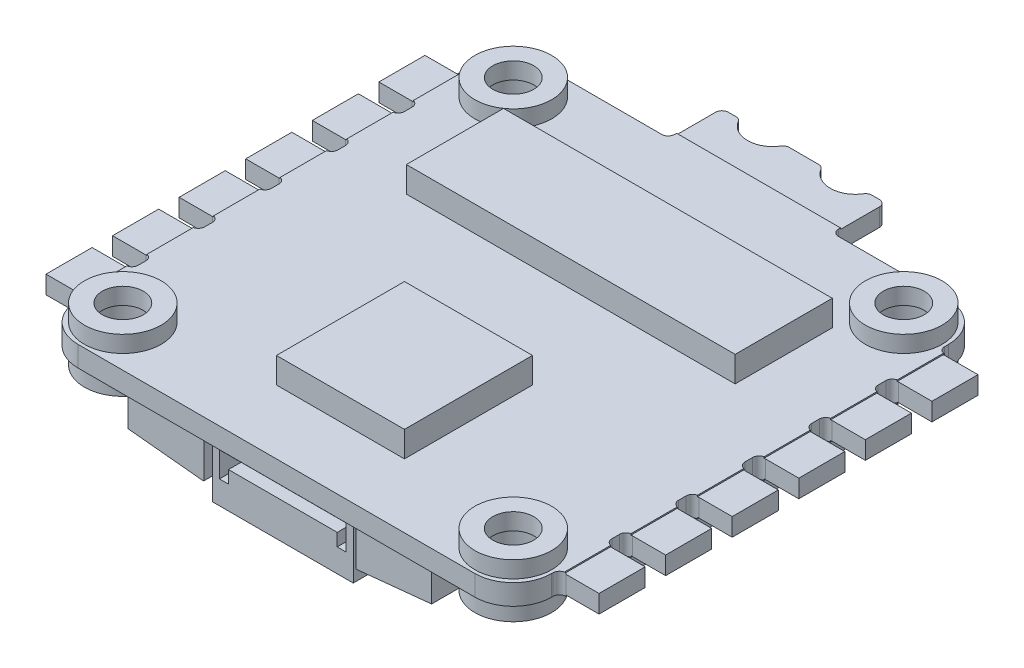
from build123d import *

# Parameters (mm, degrees)
SKETCH_1_W               = 37
SKETCH_1_H               = 37
SKETCH_1_R               = 2.25
EXTRUDE_1_DEPTH          = 1.6
FILLET_1_R               = 3
SKETCH_2_R               = 3
SKETCH_2_R_2             = 1.6
EXTRUDE_2_DEPTH          = 1.3
EXTRUDE_2_2_DEPTH        = 1.3
EXTRUDE_2_3_DEPTH        = 1.3
EXTRUDE_2_4_DEPTH        = 1.3
SKETCH_3_R               = 3
SKETCH_3_R_2             = 1.6
EXTRUDE_3_DEPTH          = 1.3
EXTRUDE_3_2_DEPTH        = 1.3
EXTRUDE_3_3_DEPTH        = 1.3
EXTRUDE_3_4_DEPTH        = 1.3
SKETCH_6_W               = 11
SKETCH_6_H               = 4.3
EXTRUDE_5_DEPTH          = 4.3
CUT_EXTRUDE_2_DEPTH      = 3.3
SKETCH_9_W               = 10
SKETCH_9_H               = 10
EXTRUDE_7_DEPTH          = 2
SKETCH_9_W_2             = 25.681025536
SKETCH_9_H_2             = 7.588093614
EXTRUDE_7_2_DEPTH        = 2
EXTRUDE_8_DEPTH          = 3
CUT_EXTRUDE_3_DEPTH      = 27.513958588
CUT_EXTRUDE_3_DEPTH_BACK = 27.513958588
SKETCH_12_W              = 3.1
SKETCH_12_H              = 3.6
EXTRUDE_9_DEPTH          = 1.6
FILLET_2_R               = 0.5
SKETCH_13_W              = 2.7
SKETCH_13_H              = 29.6
CUT_EXTRUDE_4_DEPTH      = 0.1
SKETCH_14_W              = 2.7
SKETCH_14_H              = 29.6
CUT_EXTRUDE_5_DEPTH      = 0.1
EXTRUDE_10_DEPTH         = 1.6
FILLET_3_R               = 0.5
SKETCH_16_W              = 12.8
SKETCH_16_H              = 3.89742876
CUT_EXTRUDE_6_DEPTH      = 0.1
SKETCH_17_W              = 12.8
SKETCH_17_H              = 4.147323538
CUT_EXTRUDE_7_DEPTH      = 0.1


with BuildPart() as part:
    # 草图1 → 凸台-拉伸1 (new body)
    with BuildSketch(Plane(origin=(0, 0, 0), x_dir=(1, 0, 0), z_dir=(0, 1, 0))):
        Rectangle(SKETCH_1_W, SKETCH_1_H)
        with Locations(Location((15.25, 15.25, 0), (0, 0, 270))):
            Circle(SKETCH_1_R, mode=Mode.SUBTRACT)
        with Locations(Location((15.25, -15.25, 0), (0, 0, 270))):
            Circle(SKETCH_1_R, mode=Mode.SUBTRACT)
        with Locations(Location((-15.25, -15.25, 0), (0, 0, 270))):
            Circle(SKETCH_1_R, mode=Mode.SUBTRACT)
        with Locations(Location((-15.25, 15.25, 0), (0, 0, 270))):
            Circle(SKETCH_1_R, mode=Mode.SUBTRACT)
    extrude(amount=EXTRUDE_1_DEPTH)

    # 圆角1
    fillet_1_edges = [part.edges().sort_by_distance(p)[0] for p in [
        (-18.5, 0.8, 18.5),
        (-18.5, 0.8, -18.5),
        (18.5, 0.8, -18.5),
        (18.5, 0.8, 18.5),
    ]]
    fillet(fillet_1_edges, radius=FILLET_1_R)

    # 草图12 → 凸台-拉伸9 (add)
    with BuildSketch(Plane.XZ):
        with Locations((20.05, 13.1)):
            Rectangle(SKETCH_12_W, SKETCH_12_H)
        with Locations((20.05, 7.9)):
            Rectangle(SKETCH_12_W, SKETCH_12_H)
        with Locations((20.05, 2.7)):
            Rectangle(SKETCH_12_W, SKETCH_12_H)
        with Locations((20.05, -2.5)):
            Rectangle(SKETCH_12_W, SKETCH_12_H)
        with Locations((20.05, -7.7)):
            Rectangle(SKETCH_12_W, SKETCH_12_H)
        with Locations((20.05, -12.9)):
            Rectangle(SKETCH_12_W, SKETCH_12_H)
        with Locations((-20.05, -12.9)):
            Rectangle(SKETCH_12_W, SKETCH_12_H)
        with Locations((-20.05, -7.7)):
            Rectangle(SKETCH_12_W, SKETCH_12_H)
        with Locations((-20.05, -2.5)):
            Rectangle(SKETCH_12_W, SKETCH_12_H)
        with Locations((-20.05, 2.7)):
            Rectangle(SKETCH_12_W, SKETCH_12_H)
        with Locations((-20.05, 7.9)):
            Rectangle(SKETCH_12_W, SKETCH_12_H)
        with Locations((-20.05, 13.1)):
            Rectangle(SKETCH_12_W, SKETCH_12_H)
    extrude(amount=-EXTRUDE_9_DEPTH)

    # 圆角2
    fillet_2_edges = [part.edges().sort_by_distance(p)[0] for p in [
        (18.5, 0.8, -9.5),
        (18.5, 0.8, -5.9),
        (18.5, 0.8, -14.7),
        (18.5, 0.8, -11.1),
        (-18.5, 0.8, -14.7),
        (-18.5, 0.8, -11.1),
        (-18.5, 0.8, -9.5),
        (-18.5, 0.8, -5.9),
        (-18.5, 0.8, -4.3),
        (-18.5, 0.8, -0.7),
        (-18.5, 0.8, 0.9),
        (-18.5, 0.8, 4.5),
        (-18.5, 0.8, 6.1),
        (-18.5, 0.8, 9.7),
        (-18.5, 0.8, 11.3),
        (-18.5, 0.8, 14.9),
        (18.5, 0.8, 14.9),
        (18.5, 0.8, 11.3),
        (18.5, 0.8, 6.1),
        (18.5, 0.8, 9.7),
        (18.5, 0.8, 0.9),
        (18.5, 0.8, 4.5),
        (18.5, 0.8, -4.3),
        (18.5, 0.8, -0.7),
    ]]
    fillet(fillet_2_edges, radius=FILLET_2_R)

    # 草图13 → 切除-拉伸4 (cut)
    with BuildSketch(Plane.XZ):
        with Locations((20.25, 0.1)):
            Rectangle(SKETCH_13_W, SKETCH_13_H)
        with Locations((-20.25, 0.1)):
            Rectangle(SKETCH_13_W, SKETCH_13_H)
    extrude(amount=-CUT_EXTRUDE_4_DEPTH, mode=Mode.SUBTRACT)

    # 草图14 → 切除-拉伸5 (cut)
    with BuildSketch(Plane(origin=(0, 1.6, 0), x_dir=(1, 0, 0), z_dir=(0, 1, 0))):
        with Locations((-20.25, -0.1)):
            Rectangle(SKETCH_14_W, SKETCH_14_H)
        with Locations((20.25, -0.1)):
            Rectangle(SKETCH_14_W, SKETCH_14_H)
    extrude(amount=-CUT_EXTRUDE_5_DEPTH, mode=Mode.SUBTRACT)

    # 草图15 → 凸台-拉伸10 (add)
    with BuildSketch(Plane.XZ):
        with BuildLine():
            Line((6.4, -18.5), (-6.4, -18.5))
            Line((-6.4, -18.5), (-6.4, -22.7))
            Line((-6.4, -22.7), (-5.01522308, -22.7))
            ThreePointArc((-5.01522308, -22.7), (-3.229251176, -21.535763846), (-1.443279271, -22.7))
            Line((-1.443279271, -22.7), (1.443279271, -22.7))
            ThreePointArc((1.443279271, -22.7), (3.229251176, -21.535763846), (5.01522308, -22.7))
            Line((5.01522308, -22.7), (6.4, -22.7))
            Line((6.4, -22.7), (6.4, -18.5))
        make_face()
    extrude(amount=-EXTRUDE_10_DEPTH)

    # 圆角3
    fillet_3_edges = [part.edges().sort_by_distance(p)[0] for p in [
        (-5.01522308, 0.8, -22.7),
        (-1.443279271, 0.8, -22.7),
        (1.443279271, 0.8, -22.7),
        (5.01522308, 0.8, -22.7),
        (6.4, 0.8, -22.7),
        (6.4, 0.8, -18.5),
        (-6.4, 0.8, -18.5),
        (-6.4, 0.8, -22.7),
    ]]
    fillet(fillet_3_edges, radius=FILLET_3_R)

    # 草图16 → 切除-拉伸6 (cut)
    with BuildSketch(Plane.XZ):
        with Locations((0, -21.128309583)):
            Rectangle(SKETCH_16_W, SKETCH_16_H)
    extrude(amount=-CUT_EXTRUDE_6_DEPTH, mode=Mode.SUBTRACT)

    # 草图17 → 切除-拉伸7 (cut)
    with BuildSketch(Plane(origin=(0, 1.6, 0), x_dir=(1, 0, 0), z_dir=(0, 1, 0))):
        with Locations((0, 21.232279327)):
            Rectangle(SKETCH_17_W, SKETCH_17_H)
    extrude(amount=-CUT_EXTRUDE_7_DEPTH, mode=Mode.SUBTRACT)


with BuildPart() as body_2:
    # 草图2 → 凸台-拉伸2 (new body)
    with BuildSketch(Plane.XZ):
        with Locations(Location((-15.25, 15.25, 0), (0, 0, 270))):
            Circle(SKETCH_2_R)
        with Locations(Location((-15.25, 15.25, 0), (0, 0, 270))):
            Circle(SKETCH_2_R_2, mode=Mode.SUBTRACT)
    extrude(amount=EXTRUDE_2_DEPTH)


with BuildPart() as body_3:
    # 草图2 → Extrude 2 2 (new body)
    with BuildSketch(Plane.XZ):
        with Locations(Location((15.25, 15.25, 0), (0, 0, 270))):
            Circle(SKETCH_2_R)
        with Locations(Location((15.25, 15.25, 0), (0, 0, 270))):
            Circle(SKETCH_2_R_2, mode=Mode.SUBTRACT)
    extrude(amount=EXTRUDE_2_2_DEPTH)


with BuildPart() as body_4:
    # 草图2 → Extrude 2 3 (new body)
    with BuildSketch(Plane.XZ):
        with Locations(Location((15.25, -15.25, 0), (0, 0, 270))):
            Circle(SKETCH_2_R)
        with Locations(Location((15.25, -15.25, 0), (0, 0, 270))):
            Circle(SKETCH_2_R_2, mode=Mode.SUBTRACT)
    extrude(amount=EXTRUDE_2_3_DEPTH)


with BuildPart() as body_5:
    # 草图2 → Extrude 2 4 (new body)
    with BuildSketch(Plane.XZ):
        with Locations(Location((-15.25, -15.25, 0), (0, 0, 270))):
            Circle(SKETCH_2_R)
        with Locations(Location((-15.25, -15.25, 0), (0, 0, 270))):
            Circle(SKETCH_2_R_2, mode=Mode.SUBTRACT)
    extrude(amount=EXTRUDE_2_4_DEPTH)


with BuildPart() as body_6:
    # 草图3 → 凸台-拉伸3 (new body)
    with BuildSketch(Plane(origin=(0, 1.6, 0), x_dir=(1, 0, 0), z_dir=(0, 1, 0))):
        with Locations(Location((-15.25, 15.25, 0), (0, 0, 270))):
            Circle(SKETCH_3_R)
        with Locations(Location((-15.25, 15.25, 0), (0, 0, 270))):
            Circle(SKETCH_3_R_2, mode=Mode.SUBTRACT)
    extrude(amount=EXTRUDE_3_DEPTH)


with BuildPart() as body_7:
    # 草图3 → Extrude 3 2 (new body)
    with BuildSketch(Plane(origin=(0, 1.6, 0), x_dir=(1, 0, 0), z_dir=(0, 1, 0))):
        with Locations(Location((15.25, 15.25, 0), (0, 0, 270))):
            Circle(SKETCH_3_R)
        with Locations(Location((15.25, 15.25, 0), (0, 0, 270))):
            Circle(SKETCH_3_R_2, mode=Mode.SUBTRACT)
    extrude(amount=EXTRUDE_3_2_DEPTH)


with BuildPart() as body_8:
    # 草图3 → Extrude 3 3 (new body)
    with BuildSketch(Plane(origin=(0, 1.6, 0), x_dir=(1, 0, 0), z_dir=(0, 1, 0))):
        with Locations(Location((15.25, -15.25, 0), (0, 0, 270))):
            Circle(SKETCH_3_R)
        with Locations(Location((15.25, -15.25, 0), (0, 0, 270))):
            Circle(SKETCH_3_R_2, mode=Mode.SUBTRACT)
    extrude(amount=EXTRUDE_3_3_DEPTH)


with BuildPart() as body_9:
    # 草图3 → Extrude 3 4 (new body)
    with BuildSketch(Plane(origin=(0, 1.6, 0), x_dir=(1, 0, 0), z_dir=(0, 1, 0))):
        with Locations(Location((-15.25, -15.25, 0), (0, 0, 270))):
            Circle(SKETCH_3_R)
        with Locations(Location((-15.25, -15.25, 0), (0, 0, 270))):
            Circle(SKETCH_3_R_2, mode=Mode.SUBTRACT)
    extrude(amount=EXTRUDE_3_4_DEPTH)


with BuildPart() as body_10:
    # 草图6 → 凸台-拉伸5 (new body)
    with BuildSketch(Plane.XZ):
        with Locations((0, 15.85)):
            Rectangle(SKETCH_6_W, SKETCH_6_H)
    extrude(amount=EXTRUDE_5_DEPTH)

    # 草图7 → 切除-拉伸2 (cut)
    with BuildSketch(Plane.XY.offset(18)):
        Polygon((4.950495816, -0.508278275), (-4.950495816, -0.508278275), (-4.950495816, -2.479645692), (-4.247332915, -2.479645692), (-4.247332915, -1.493961983), (4.247332915, -1.493961983), (4.247332915, -2.479645692), (4.950495816, -2.479645692), align=None)
    extrude(amount=-CUT_EXTRUDE_2_DEPTH, mode=Mode.SUBTRACT)


with BuildPart() as body_11:
    # 草图9 → 凸台-拉伸7 (new body)
    with BuildSketch(Plane(origin=(0, 1.6, 0), x_dir=(1, 0, 0), z_dir=(0, 1, 0))):
        with Locations((0, -8.5)):
            Rectangle(SKETCH_9_W, SKETCH_9_H)
    extrude(amount=EXTRUDE_7_DEPTH)


with BuildPart() as body_12:
    # 草图9 → Extrude 7 2 (new body)
    with BuildSketch(Plane(origin=(0, 1.6, 0), x_dir=(1, 0, 0), z_dir=(0, 1, 0))):
        with Locations((0, 8.283099186)):
            Rectangle(SKETCH_9_W_2, SKETCH_9_H_2)
    extrude(amount=EXTRUDE_7_2_DEPTH)


with BuildPart() as body_13:
    # 草图10 → 凸台-拉伸8 (new body)
    with BuildSketch(Plane.XZ):
        Polygon((5.947424725, 13.239286457), (-5.947424725, 13.239286457), (-5.947424725, 18.229654329), (-11.849275314, 18.229654329), (-11.849275314, 11.89484945), (-18.161293125, 11.89484945), (-18.161293125, -11.872062382), (-11.872062382, -11.872062382), (-11.872062382, -17.933422446), (-5.67397991, -17.933422446), (-4.14724636, -16.930791458), (4.14724636, -16.930791458), (5.67397991, -17.933422446), (11.872062382, -17.933422446), (11.872062382, -11.872062382), (18.161293125, -11.872062382), (18.161293125, 11.89484945), (11.849275314, 11.89484945), (11.849275314, 18.229654329), (5.947424725, 18.229654329), align=None)
    extrude(amount=EXTRUDE_8_DEPTH)

    # 草图11 → 切除-拉伸3 (cut, two sides: drawn at the far end of the back side and taken through both)
    with BuildSketch(Plane.XY.offset(-CUT_EXTRUDE_3_DEPTH_BACK)):
        Polygon((18.161293125, -1.793871485), (6.127649717, -3), (18.161293125, -3), align=None)
        Polygon((-18.161293125, -3), (-18.161293125, -1.793871485), (-6.127649717, -3), align=None)
    extrude(amount=CUT_EXTRUDE_3_DEPTH + CUT_EXTRUDE_3_DEPTH_BACK, mode=Mode.SUBTRACT)


solid = Compound([part.part, body_2.part, body_3.part, body_4.part, body_5.part, body_6.part, body_7.part, body_8.part, body_9.part, body_10.part, body_11.part, body_12.part, body_13.part])
